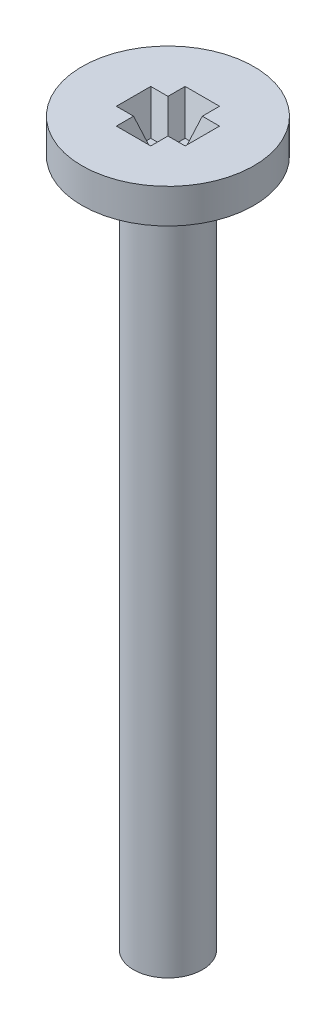
from build123d import *

# Parameters (mm, degrees)
SKETCH1_R                         = 5
BOSS_EXTRUDE1_DEPTH               = 2
SKETCH2_W                         = 2
SKETCH2_H                         = 4
CUT_EXTRUDE_THIN1_DEPTH           = 2
CUT_EXTRUDE_THIN1_DRAFT           = -17
SKETCH2_W_2                       = 4
SKETCH2_H_2                       = 2
CUT_EXTRUDE_THIN1_PROFILE_2_DEPTH = 2
CUT_EXTRUDE_THIN1_PROFILE_2_DRAFT = -17
SKETCH3_R                         = 2
BOSS_EXTRUDE2_DEPTH               = 40


with BuildPart() as part:
    # Sketch1 → Boss-Extrude1 (new body)
    with BuildSketch(Plane(origin=(0, 0, 0), x_dir=(1, 0, 0), z_dir=(0, 1, 0))):
        with Locations(Location((0, 0, 0), (0, 0, 270))):
            Circle(SKETCH1_R)
    extrude(amount=BOSS_EXTRUDE1_DEPTH)


with BuildPart() as cut_extrude_thin1_tool:
    # Sketch2 → Cut-Extrude-Thin1 (with draft: the straight prism first)
    with BuildSketch(Plane(origin=(0, 2, 0), x_dir=(1, 0, 0), z_dir=(0, 1, 0))):
        Rectangle(SKETCH2_W, SKETCH2_H)
    extrude(amount=-CUT_EXTRUDE_THIN1_DEPTH)
    # Cut-Extrude-Thin1: the draft: its side faces are tilted about the plane it starts from
    cut_extrude_thin1_sides = [cut_extrude_thin1_tool.faces().sort_by_distance(p)[0] for p in [
        (1, 1, 0),
        (0, 1, -2),
        (-1, 1, 0),
        (0, 1, 2),
    ]]
    draft(cut_extrude_thin1_sides, Plane(origin=(0, 2, 0), x_dir=(1, 0, 0), z_dir=(0, 1, 0)), CUT_EXTRUDE_THIN1_DRAFT)


with BuildPart() as part_1:
    add(part.part)

    # Cut-Extrude-Thin1: cut by cut_extrude_thin1_tool
    add(cut_extrude_thin1_tool.part, mode=Mode.SUBTRACT)


with BuildPart() as cut_extrude_thin1_profile_2_tool:
    # Sketch2 → Cut-Extrude-Thin1 profile 2 (with draft: the straight prism first)
    with BuildSketch(Plane(origin=(0, 2, 0), x_dir=(1, 0, 0), z_dir=(0, 1, 0))):
        Rectangle(SKETCH2_W_2, SKETCH2_H_2)
    extrude(amount=-CUT_EXTRUDE_THIN1_PROFILE_2_DEPTH)
    # Cut-Extrude-Thin1 profile 2: the draft: its side faces are tilted about the plane it starts from
    cut_extrude_thin1_profile_2_sides = [cut_extrude_thin1_profile_2_tool.faces().sort_by_distance(p)[0] for p in [
        (0, 1, 1),
        (2, 1, 0),
        (0, 1, -1),
        (-2, 1, 0),
    ]]
    draft(cut_extrude_thin1_profile_2_sides, Plane(origin=(0, 2, 0), x_dir=(1, 0, 0), z_dir=(0, 1, 0)), CUT_EXTRUDE_THIN1_PROFILE_2_DRAFT)


with BuildPart() as part_2:
    add(part_1.part)

    # Cut-Extrude-Thin1 profile 2: cut by cut_extrude_thin1_profile_2_tool
    add(cut_extrude_thin1_profile_2_tool.part, mode=Mode.SUBTRACT)

    # Sketch3 → Boss-Extrude2 (add)
    with BuildSketch(Plane.XZ):
        with Locations(Location((0, 0, 0), (0, 0, 90))):
            Circle(SKETCH3_R)
    extrude(amount=BOSS_EXTRUDE2_DEPTH)


solid = part_2.part
